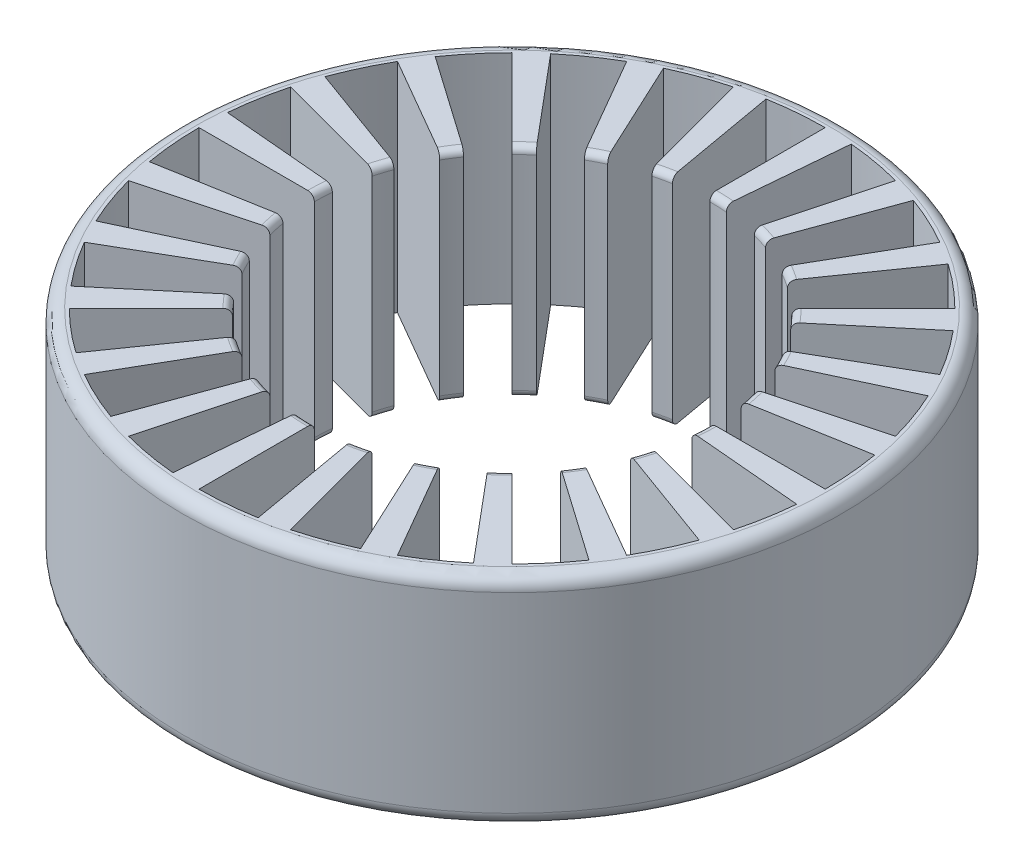
from build123d import *

# Parameters (mm, degrees)
SKETCH_1_R          = 25
EXTRUDE_1_DEPTH     = 16.5
SKETCH_2_R          = 15
CUT_EXTRUDE_2_DEPTH = 19
CUT_EXTRUDE_3_DEPTH = 19
FILLET_1_R          = 1
FILLET_2_R          = 1
FILLET_3_R          = 0.5
FILLET_4_R          = 0.5


with BuildPart() as part:
    # 草图1 → 凸台-拉伸1 (new body)
    with BuildSketch(Plane(origin=(0, 0, 0), x_dir=(1, 0, 0), z_dir=(0, 1, 0))):
        with Locations(Location((0, 0, 0), (0, 0, 270))):
            Circle(SKETCH_1_R)
    extrude(amount=EXTRUDE_1_DEPTH)

    # 草图2 → 切除-拉伸2 (cut)
    with BuildSketch(Plane.XZ):
        with Locations(Location((0, 0, 0), (0, 0, 270))):
            Circle(SKETCH_2_R)
    extrude(amount=-CUT_EXTRUDE_2_DEPTH, mode=Mode.SUBTRACT)

    # 草图3 → 切除-拉伸3 (cut)
    with BuildSketch(Plane.XZ):
        with BuildLine():
            Line((-20.56810334, 11.875), (-12.990381057, 7.5))
            ThreePointArc((-12.990381057, 7.5), (-12.287280664, 8.603646545), (-11.490666647, 9.641814145))
            Line((-11.490666647, 9.641814145), (-18.193555524, 15.26620573))
            ThreePointArc((-18.193555524, 15.26620573), (-19.454861052, 13.622440363), (-20.56810334, 11.875))
        make_face()
        with BuildLine():
            Line((-16.793786053, 16.793786053), (-10.606601718, 10.606601718))
            ThreePointArc((-10.606601718, 10.606601718), (-9.641814145, 11.490666647), (-8.603646545, 12.287280664))
            Line((-8.603646545, 12.287280664), (-13.622440363, 19.454861052))
            ThreePointArc((-13.622440363, 19.454861052), (-15.26620573, 18.193555524), (-16.793786053, 16.793786053))
        make_face()
        with BuildLine():
            Line((-11.875, 20.56810334), (-7.5, 12.990381057))
            ThreePointArc((-7.5, 12.990381057), (-6.339273926, 13.594616806), (-5.13030215, 14.095389312))
            Line((-5.13030215, 14.095389312), (-8.122978404, 22.317699744))
            ThreePointArc((-8.122978404, 22.317699744), (-10.037183716, 21.524809942), (-11.875, 20.56810334))
        make_face()
        with BuildLine():
            Line((-6.146952321, 22.940738374), (-3.882285677, 14.488887394))
            ThreePointArc((-3.882285677, 14.488887394), (-2.604722665, 14.772116295), (-1.307336141, 14.942920471))
            Line((-1.307336141, 14.942920471), (-2.06994889, 23.65962408))
            ThreePointArc((-2.06994889, 23.65962408), (-4.12414422, 23.389184134), (-6.146952321, 22.940738374))
        make_face()
        with BuildLine():
            Line((0, 23.75), (0, 15))
            ThreePointArc((0, 15), (1.307336141, 14.942920471), (2.604722665, 14.772116295))
            Line((2.604722665, 14.772116295), (4.12414422, 23.389184134))
            ThreePointArc((4.12414422, 23.389184134), (2.06994889, 23.65962408), (0, 23.75))
        make_face()
        with BuildLine():
            Line((6.146952321, 22.940738374), (3.882285677, 14.488887394))
            ThreePointArc((3.882285677, 14.488887394), (5.13030215, 14.095389312), (6.339273926, 13.594616806))
            Line((6.339273926, 13.594616806), (10.037183716, 21.524809942))
            ThreePointArc((10.037183716, 21.524809942), (8.122978404, 22.317699744), (6.146952321, 22.940738374))
        make_face()
        with BuildLine():
            Line((11.875, 20.56810334), (7.5, 12.990381057))
            ThreePointArc((7.5, 12.990381057), (8.603646545, 12.287280664), (9.641814145, 11.490666647))
            Line((9.641814145, 11.490666647), (15.26620573, 18.193555524))
            ThreePointArc((15.26620573, 18.193555524), (13.622440363, 19.454861052), (11.875, 20.56810334))
        make_face()
        with BuildLine():
            Line((16.793786053, 16.793786053), (10.606601718, 10.606601718))
            ThreePointArc((10.606601718, 10.606601718), (11.490666647, 9.641814145), (12.287280664, 8.603646545))
            Line((12.287280664, 8.603646545), (19.454861052, 13.622440363))
            ThreePointArc((19.454861052, 13.622440363), (18.193555524, 15.26620573), (16.793786053, 16.793786053))
        make_face()
        with BuildLine():
            Line((20.56810334, 11.875), (12.990381057, 7.5))
            ThreePointArc((12.990381057, 7.5), (13.594616806, 6.339273926), (14.095389312, 5.13030215))
            Line((14.095389312, 5.13030215), (22.317699744, 8.122978404))
            ThreePointArc((22.317699744, 8.122978404), (21.524809942, 10.037183716), (20.56810334, 11.875))
        make_face()
        with BuildLine():
            Line((22.940738374, 6.146952321), (14.488887394, 3.882285677))
            ThreePointArc((14.488887394, 3.882285677), (14.772116295, 2.604722665), (14.942920471, 1.307336141))
            Line((14.942920471, 1.307336141), (23.65962408, 2.06994889))
            ThreePointArc((23.65962408, 2.06994889), (23.389184134, 4.12414422), (22.940738374, 6.146952321))
        make_face()
        with BuildLine():
            Line((23.75, 0), (15, 0))
            ThreePointArc((15, 0), (14.942920471, -1.307336141), (14.772116295, -2.604722665))
            Line((14.772116295, -2.604722665), (23.389184134, -4.12414422))
            ThreePointArc((23.389184134, -4.12414422), (23.65962408, -2.06994889), (23.75, 0))
        make_face()
        with BuildLine():
            Line((22.940738374, -6.146952321), (14.488887394, -3.882285677))
            ThreePointArc((14.488887394, -3.882285677), (14.095389312, -5.13030215), (13.594616806, -6.339273926))
            Line((13.594616806, -6.339273926), (21.524809942, -10.037183716))
            ThreePointArc((21.524809942, -10.037183716), (22.317699744, -8.122978404), (22.940738374, -6.146952321))
        make_face()
        with BuildLine():
            Line((20.56810334, -11.875), (12.990381057, -7.5))
            ThreePointArc((12.990381057, -7.5), (12.287280664, -8.603646545), (11.490666647, -9.641814145))
            Line((11.490666647, -9.641814145), (18.193555524, -15.26620573))
            ThreePointArc((18.193555524, -15.26620573), (19.454861052, -13.622440363), (20.56810334, -11.875))
        make_face()
        with BuildLine():
            Line((16.793786053, -16.793786053), (10.606601718, -10.606601718))
            ThreePointArc((10.606601718, -10.606601718), (9.641814145, -11.490666647), (8.603646545, -12.287280664))
            Line((8.603646545, -12.287280664), (13.622440363, -19.454861052))
            ThreePointArc((13.622440363, -19.454861052), (15.26620573, -18.193555524), (16.793786053, -16.793786053))
        make_face()
        with BuildLine():
            Line((11.875, -20.56810334), (7.5, -12.990381057))
            ThreePointArc((7.5, -12.990381057), (6.339273926, -13.594616806), (5.13030215, -14.095389312))
            Line((5.13030215, -14.095389312), (8.122978404, -22.317699744))
            ThreePointArc((8.122978404, -22.317699744), (10.037183716, -21.524809942), (11.875, -20.56810334))
        make_face()
        with BuildLine():
            Line((6.146952321, -22.940738374), (3.882285677, -14.488887394))
            ThreePointArc((3.882285677, -14.488887394), (2.604722665, -14.772116295), (1.307336141, -14.942920471))
            Line((1.307336141, -14.942920471), (2.06994889, -23.65962408))
            ThreePointArc((2.06994889, -23.65962408), (4.12414422, -23.389184134), (6.146952321, -22.940738374))
        make_face()
        with BuildLine():
            Line((0, -23.75), (0, -15))
            ThreePointArc((0, -15), (-1.307336141, -14.942920471), (-2.604722665, -14.772116295))
            Line((-2.604722665, -14.772116295), (-4.12414422, -23.389184134))
            ThreePointArc((-4.12414422, -23.389184134), (-2.06994889, -23.65962408), (0, -23.75))
        make_face()
        with BuildLine():
            Line((-6.146952321, -22.940738374), (-3.882285677, -14.488887394))
            ThreePointArc((-3.882285677, -14.488887394), (-5.13030215, -14.095389312), (-6.339273926, -13.594616806))
            Line((-6.339273926, -13.594616806), (-10.037183716, -21.524809942))
            ThreePointArc((-10.037183716, -21.524809942), (-8.122978404, -22.317699744), (-6.146952321, -22.940738374))
        make_face()
        with BuildLine():
            Line((-11.875, -20.56810334), (-7.5, -12.990381057))
            ThreePointArc((-7.5, -12.990381057), (-8.603646545, -12.287280664), (-9.641814145, -11.490666647))
            Line((-9.641814145, -11.490666647), (-15.26620573, -18.193555524))
            ThreePointArc((-15.26620573, -18.193555524), (-13.622440363, -19.454861052), (-11.875, -20.56810334))
        make_face()
        with BuildLine():
            Line((-16.793786053, -16.793786053), (-10.606601718, -10.606601718))
            ThreePointArc((-10.606601718, -10.606601718), (-11.490666647, -9.641814145), (-12.287280664, -8.603646545))
            Line((-12.287280664, -8.603646545), (-19.454861052, -13.622440363))
            ThreePointArc((-19.454861052, -13.622440363), (-18.193555524, -15.26620573), (-16.793786053, -16.793786053))
        make_face()
        with BuildLine():
            Line((-20.56810334, -11.875), (-12.990381057, -7.5))
            ThreePointArc((-12.990381057, -7.5), (-13.594616806, -6.339273926), (-14.095389312, -5.13030215))
            Line((-14.095389312, -5.13030215), (-22.317699744, -8.122978404))
            ThreePointArc((-22.317699744, -8.122978404), (-21.524809942, -10.037183716), (-20.56810334, -11.875))
        make_face()
        with BuildLine():
            Line((-22.940738374, -6.146952321), (-14.488887394, -3.882285677))
            ThreePointArc((-14.488887394, -3.882285677), (-14.772116295, -2.604722665), (-14.942920471, -1.307336141))
            Line((-14.942920471, -1.307336141), (-23.65962408, -2.06994889))
            ThreePointArc((-23.65962408, -2.06994889), (-23.389184134, -4.12414422), (-22.940738374, -6.146952321))
        make_face()
        with BuildLine():
            Line((-23.75, 0), (-15, 0))
            ThreePointArc((-15, 0), (-14.942920471, 1.307336141), (-14.772116295, 2.604722665))
            Line((-14.772116295, 2.604722665), (-23.389184134, 4.12414422))
            ThreePointArc((-23.389184134, 4.12414422), (-23.65962408, 2.06994889), (-23.75, 0))
        make_face()
        with BuildLine():
            Line((-22.940738374, 6.146952321), (-14.488887394, 3.882285677))
            ThreePointArc((-14.488887394, 3.882285677), (-14.095389312, 5.13030215), (-13.594616806, 6.339273926))
            Line((-13.594616806, 6.339273926), (-21.524809942, 10.037183716))
            ThreePointArc((-21.524809942, 10.037183716), (-22.317699744, 8.122978404), (-22.940738374, 6.146952321))
        make_face()
    extrude(amount=-CUT_EXTRUDE_3_DEPTH, mode=Mode.SUBTRACT)

    # 圆角1
    fillet_1_edges = [part.edges().sort_by_distance(p)[0] for p in [
        (0, 0, -25),
    ]]
    fillet(fillet_1_edges, radius=FILLET_1_R)

    # 圆角2
    fillet_2_edges = [part.edges().sort_by_distance(p)[0] for p in [
        (0, 16.5, -25),
    ]]
    fillet(fillet_2_edges, radius=FILLET_2_R)

    # 圆角3
    fillet_3_edges = [part.edges().sort_by_distance(p)[0] for p in [
        (3.246594209, 16.5, 14.644440107),
        (6.926229199, 16.5, 13.305162498),
        (10.133853114, 16.5, 11.059160052),
        (12.650871687, 16.5, 8.059494125),
        (14.305754261, 16.5, 4.510586993),
        (14.985723324, 16.5, 0.65429081),
        (14.644440107, 16.5, -3.246594209),
        (13.305162498, 16.5, -6.926229199),
        (11.059160052, 16.5, -10.133853114),
        (8.059494125, 16.5, -12.650871687),
        (4.510586993, 16.5, -14.305754261),
        (0.65429081, 16.5, -14.985723324),
        (-3.246594209, 16.5, -14.644440107),
        (-6.926229199, 16.5, -13.305162498),
        (-10.133853114, 16.5, -11.059160052),
        (-12.650871687, 16.5, -8.059494125),
        (-14.305754261, 16.5, -4.510586993),
        (-14.985723324, 16.5, -0.65429081),
        (-14.644440107, 16.5, 3.246594209),
        (-13.305162498, 16.5, 6.926229199),
        (-11.059160052, 16.5, 10.133853114),
        (-8.059494125, 16.5, 12.650871687),
        (-4.510586993, 16.5, 14.305754261),
        (-0.65429081, 16.5, 14.985723324),
    ]]
    fillet(fillet_3_edges, radius=FILLET_3_R)

    # 圆角4
    fillet_4_edges = [part.edges().sort_by_distance(p)[0] for p in [
        (4.510586993, 0, -14.305754261),
        (8.059494125, 0, -12.650871687),
        (11.059160052, 0, -10.133853114),
        (13.305162498, 0, -6.926229199),
        (14.644440107, 0, -3.246594209),
        (14.985723324, 0, 0.65429081),
        (14.305754261, 0, 4.510586993),
        (12.650871687, 0, 8.059494125),
        (10.133853114, 0, 11.059160052),
        (6.926229199, 0, 13.305162498),
        (3.246594209, 0, 14.644440107),
        (-0.65429081, 0, 14.985723324),
        (-4.510586993, 0, 14.305754261),
        (-8.059494125, 0, 12.650871687),
        (-11.059160052, 0, 10.133853114),
        (-13.305162498, 0, 6.926229199),
        (-14.644440107, 0, 3.246594209),
        (-14.985723324, 0, -0.65429081),
        (-14.305754261, 0, -4.510586993),
        (-12.650871687, 0, -8.059494125),
        (-10.133853114, 0, -11.059160052),
        (-6.926229199, 0, -13.305162498),
        (-3.246594209, 0, -14.644440107),
        (0.65429081, 0, -14.985723324),
    ]]
    fillet(fillet_4_edges, radius=FILLET_4_R)


solid = part.part
